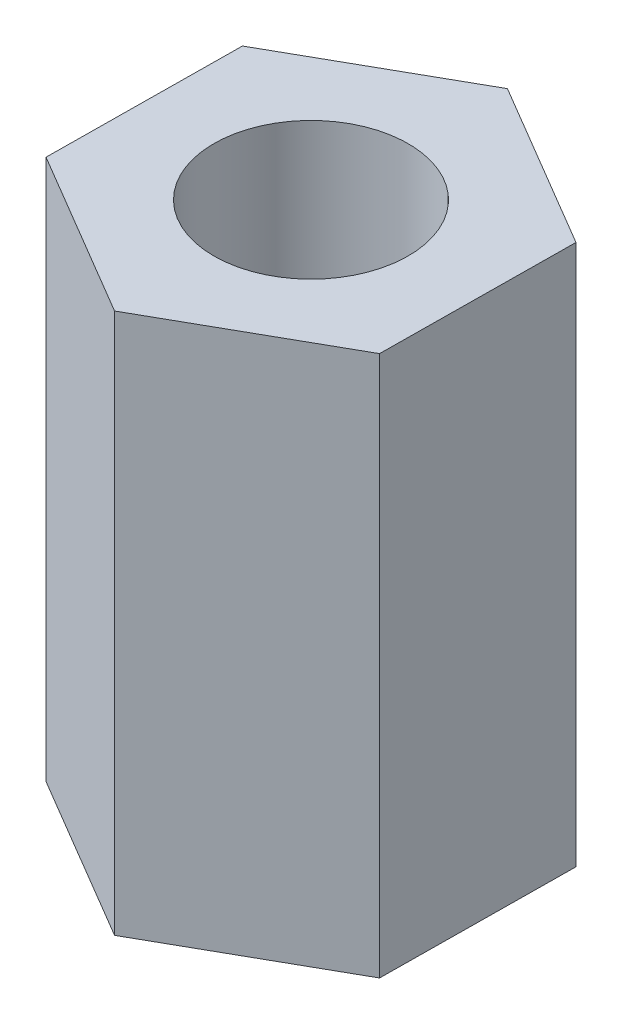
from build123d import *

# Parameters (mm, degrees)
SKETCH_1_R      = 1.5
EXTRUDE_1_DEPTH = 8.34


with BuildPart() as part:
    # 草图1 → 凸台-拉伸1 (new body)
    with BuildSketch(Plane(origin=(0, 0, 0), x_dir=(1, 0, 0), z_dir=(0, 1, 0))):
        Polygon((-2.583044483, 1.525739558), (-2.612851459, -1.474112362), (-0.029806976, -2.99985192), (2.583044483, -1.525739558), (2.612851459, 1.474112362), (0.029806976, 2.99985192), align=None)
        with Locations(Location((0, 0, 0), (0, 0, 270))):
            Circle(SKETCH_1_R, mode=Mode.SUBTRACT)
    extrude(amount=EXTRUDE_1_DEPTH)


solid = part.part
